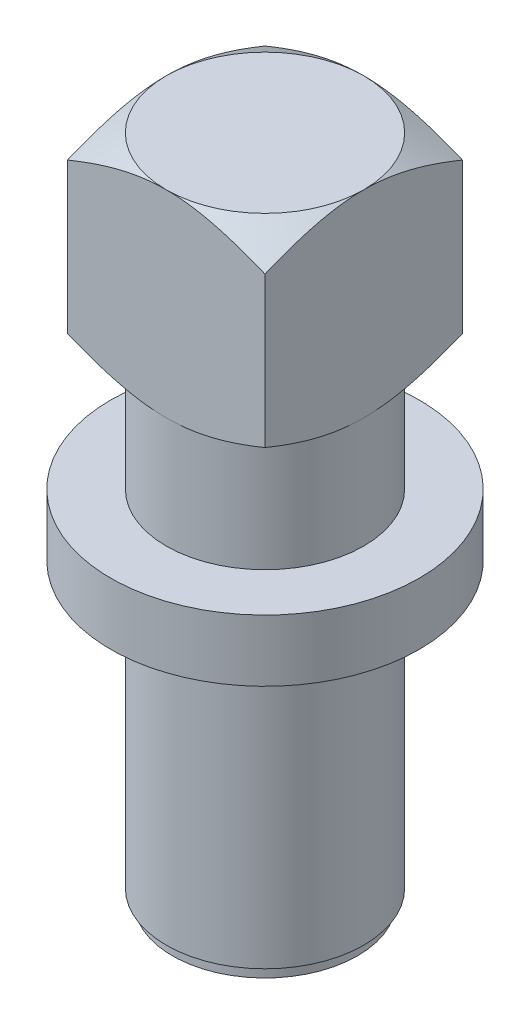
from build123d import *

# Parameters (mm, degrees)
SKETCH2_W           = 16
SKETCH2_H           = 16
BOSS_EXTRUDE1_DEPTH = 16
SKETCH3_OUTSIDE_W   = 240.202
SKETCH3_OUTSIDE_H   = 240.202
SKETCH3_OUTSIDE_R   = 8
CUT_EXTRUDE1_DEPTH  = 57.819890883
CUT_EXTRUDE1_DRAFT  = -60
SKETCH4_OUTSIDE_W   = 188.556
SKETCH4_OUTSIDE_H   = 188.556
SKETCH4_OUTSIDE_R   = 8
CUT_EXTRUDE2_DEPTH  = 42.910619179
CUT_EXTRUDE2_DRAFT  = -60


with BuildPart() as part:
    # Sketch1 → Revolve1 (revolve)
    with BuildSketch(Plane.XY):
        Polygon((0, 0), (-7.5, 0), (-7.5, 1), (-8, 1), (-8, 24), (-12.5, 24), (-12.5, 29), (-8, 29), (-8, 38), (0, 38), align=None)
    revolve(axis=Axis((0, 38, 0), (0, -1, 0)))

    # Sketch2 → Boss-Extrude1 (add)
    with BuildSketch(Plane(origin=(0, 38, 0), x_dir=(1, 0, 0), z_dir=(0, 1, 0))):
        Rectangle(SKETCH2_W, SKETCH2_H)
    extrude(amount=BOSS_EXTRUDE1_DEPTH)


with BuildPart() as cut_extrude1_tool:
    # Sketch3 outside → Cut-Extrude1 (with draft: the straight prism first)
    with BuildSketch(Plane(origin=(0, 54, 0), x_dir=(1, 0, 0), z_dir=(0, 1, 0))):
        Rectangle(SKETCH3_OUTSIDE_W, SKETCH3_OUTSIDE_H)
        with Locations(Location((0, 0, 0), (0, 0, 180))):
            Circle(SKETCH3_OUTSIDE_R, mode=Mode.SUBTRACT)
    extrude(amount=-CUT_EXTRUDE1_DEPTH)
    # Cut-Extrude1: the draft: its side faces are tilted about the plane it starts from
    cut_extrude1_sides = [cut_extrude1_tool.faces().sort_by_distance(p)[0] for p in [
        (0, 25.090054558, 120.101),
        (120.101, 25.090054558, 0),
        (0, 25.090054558, -120.101),
        (-120.101, 25.090054558, 0),
        (8, 25.090054558, 0),
    ]]
    draft(cut_extrude1_sides, Plane(origin=(0, 54, 0), x_dir=(1, 0, 0), z_dir=(0, 1, 0)), CUT_EXTRUDE1_DRAFT)


with BuildPart() as part_1:
    add(part.part)

    # Cut-Extrude1: cut by cut_extrude1_tool
    add(cut_extrude1_tool.part, mode=Mode.SUBTRACT)


with BuildPart() as cut_extrude2_tool:
    # Sketch4 outside → Cut-Extrude2 (with draft: the straight prism first)
    with BuildSketch(Plane.XZ.offset(-38)):
        Rectangle(SKETCH4_OUTSIDE_W, SKETCH4_OUTSIDE_H)
        with Locations(Location((0, 0, 0), (0, 0, 180))):
            Circle(SKETCH4_OUTSIDE_R, mode=Mode.SUBTRACT)
    extrude(amount=-CUT_EXTRUDE2_DEPTH)
    # Cut-Extrude2: the draft: its side faces are tilted about the plane it starts from
    cut_extrude2_sides = [cut_extrude2_tool.faces().sort_by_distance(p)[0] for p in [
        (0, 59.45530959, -94.278),
        (94.278, 59.45530959, 0),
        (0, 59.45530959, 94.278),
        (-94.278, 59.45530959, 0),
        (8, 59.45530959, 0),
    ]]
    draft(cut_extrude2_sides, Plane.XZ.offset(-38), CUT_EXTRUDE2_DRAFT)


with BuildPart() as part_2:
    add(part_1.part)

    # Cut-Extrude2: cut by cut_extrude2_tool
    add(cut_extrude2_tool.part, mode=Mode.SUBTRACT)


solid = part_2.part
